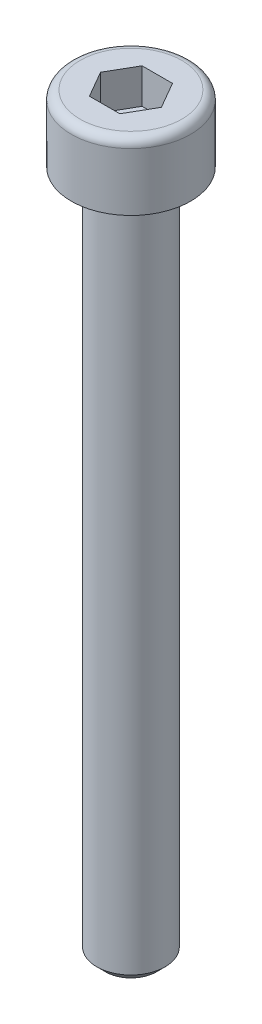
from build123d import *

# Parameters (mm, degrees)
ENL_V_MAT_EXTRU_1_DEPTH = 2


with BuildPart() as part:
    # Esquisse1 → Révolution1 (revolve)
    with BuildSketch(Plane.XY):
        with BuildLine():
            Line((0, 3.8), (-2.9, 3.8))
            ThreePointArc((-2.9, 3.8), (-3.253553391, 3.653553391), (-3.4, 3.3))
            Line((-3.4, 3.3), (-3.4, 0))
            Line((-3.4, 0), (-1.95, 0))
            Line((-1.95, 0), (-1.95, -38.5))
            Line((-1.95, -38.5), (-1.45, -39))
            Line((-1.45, -39), (0, -39))
            Line((0, -39), (0, 3.8))
        make_face()
    revolve(axis=Axis((0, 3.8, 0), (0, -1, 0)))

    # Esquisse2 → Enlèv. mat.-Extru.1 (cut)
    with BuildSketch(Plane(origin=(0, 3.8, 0), x_dir=(-1, 0, 0), z_dir=(0, 1, 0))):
        Polygon((-1.732050808, 0), (-0.866025404, -1.5), (0.866025404, -1.5), (1.732050808, 0), (0.866025404, 1.5), (-0.866025404, 1.5), align=None)
    extrude(amount=-ENL_V_MAT_EXTRU_1_DEPTH, mode=Mode.SUBTRACT)


solid = part.part
